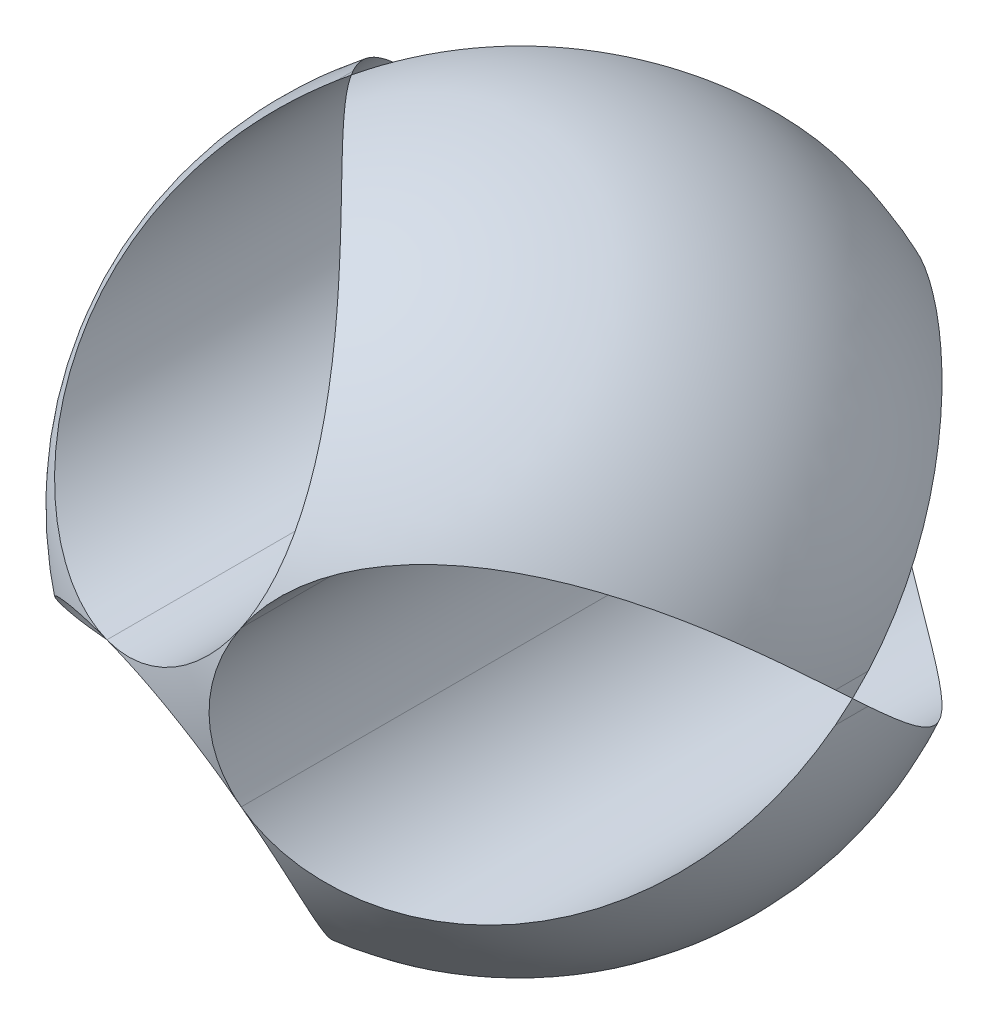
from build123d import *

# Parameters (mm, degrees)
EXTRUDE_1_DEPTH   = 50
EXTRUDE_1_2_DEPTH = 50
EXTRUDE_1_3_DEPTH = 50
EXTRUDE_1_4_DEPTH = 50


with BuildPart() as part:
    # 草图2 → 凸台-拉伸1 (new, symmetric)
    with BuildSketch(Plane.XY):
        with BuildLine():
            ThreePointArc((4.019237383, 6.961523355), (19.680501166, 13.448632213), (30, 0))
            ThreePointArc((30, 0), (14.999999961, 25.980762136), (-15.000000079, 25.980762068))
            ThreePointArc((-15.000000079, 25.980762068), (1.806606527, 23.768130107), (4.019237383, 6.961523355))
        make_face()
    extrude(amount=EXTRUDE_1_DEPTH, both=True)


with BuildPart() as body_2:
    # 草图2 → Extrude 1 2 (new, symmetric)
    with BuildSketch(Plane.XY):
        with BuildLine():
            ThreePointArc((-14.999999617, -25.980762335), (15.000000192, -25.980762003), (30, 0))
            ThreePointArc((30, 0), (19.680501101, -13.44863223), (4.019237316, -6.96152324))
            ThreePointArc((4.019237316, -6.96152324), (1.806606763, -23.768129871), (-14.999999617, -25.980762335))
        make_face()
    extrude(amount=EXTRUDE_1_2_DEPTH, both=True)


with BuildPart() as body_3:
    # 草图2 → Extrude 1 3 (new, symmetric)
    with BuildSketch(Plane.XY):
        with BuildLine():
            ThreePointArc((-8.038475803, 0), (-21.487107848, 10.319498319), (-15.000000079, 25.980762068))
            ThreePointArc((-15.000000079, 25.980762068), (-30, -2.67e-07), (-14.999999617, -25.980762335))
            ThreePointArc((-14.999999617, -25.980762335), (-21.487107917, -10.319498576), (-8.038475803, 0))
        make_face()
    extrude(amount=EXTRUDE_1_3_DEPTH, both=True)


with BuildPart() as body_4:
    # 草图2 → Extrude 1 4 (new, symmetric)
    with BuildSketch(Plane.XY):
        with BuildLine():
            ThreePointArc((4.019237316, -6.96152324), (2.153903092, 6.7e-08), (4.019237383, 6.961523355))
            ThreePointArc((4.019237383, 6.961523355), (-1.076951995, 1.865334536), (-8.038475803, 0))
            ThreePointArc((-8.038475803, 0), (-1.076952053, -1.865334502), (4.019237316, -6.96152324))
        make_face()
    extrude(amount=EXTRUDE_1_4_DEPTH, both=True)


with BuildPart() as cut_revolve_2_tool:
    # 草图3 → 切除-旋转2 (revolve)
    with BuildSketch(Plane(origin=(0, 0, 0), x_dir=(0, 0, -1), z_dir=(1, 0, 0))):
        with BuildLine():
            Line((0, 30), (0, 36.758603044))
            Line((0, 36.758603044), (-96.597700894, 36.758603044))
            Line((-96.597700894, 36.758603044), (-96.597700894, -39.921748707))
            Line((-96.597700894, -39.921748707), (0, -41.427468265))
            Line((0, -41.427468265), (0, -30))
            ThreePointArc((0, -30), (-30, 0), (0, 30))
        make_face()
    revolve(axis=Axis((0, 30, 0), (0, 1, 0)))


with BuildPart() as part_1:
    add(part.part)

    # 切除-旋转2: cut by cut_revolve_2_tool
    add(cut_revolve_2_tool.part, mode=Mode.SUBTRACT)


with BuildPart() as body_2_1:
    add(body_2.part)

    # 切除-旋转2: cut by cut_revolve_2_tool
    add(cut_revolve_2_tool.part, mode=Mode.SUBTRACT)


with BuildPart() as body_3_1:
    add(body_3.part)

    # 切除-旋转2: cut by cut_revolve_2_tool
    add(cut_revolve_2_tool.part, mode=Mode.SUBTRACT)


with BuildPart() as body_4_1:
    add(body_4.part)

    # 切除-旋转2: cut by cut_revolve_2_tool
    add(cut_revolve_2_tool.part, mode=Mode.SUBTRACT)


solid = Compound([part_1.part, body_2_1.part, body_3_1.part, body_4_1.part])
